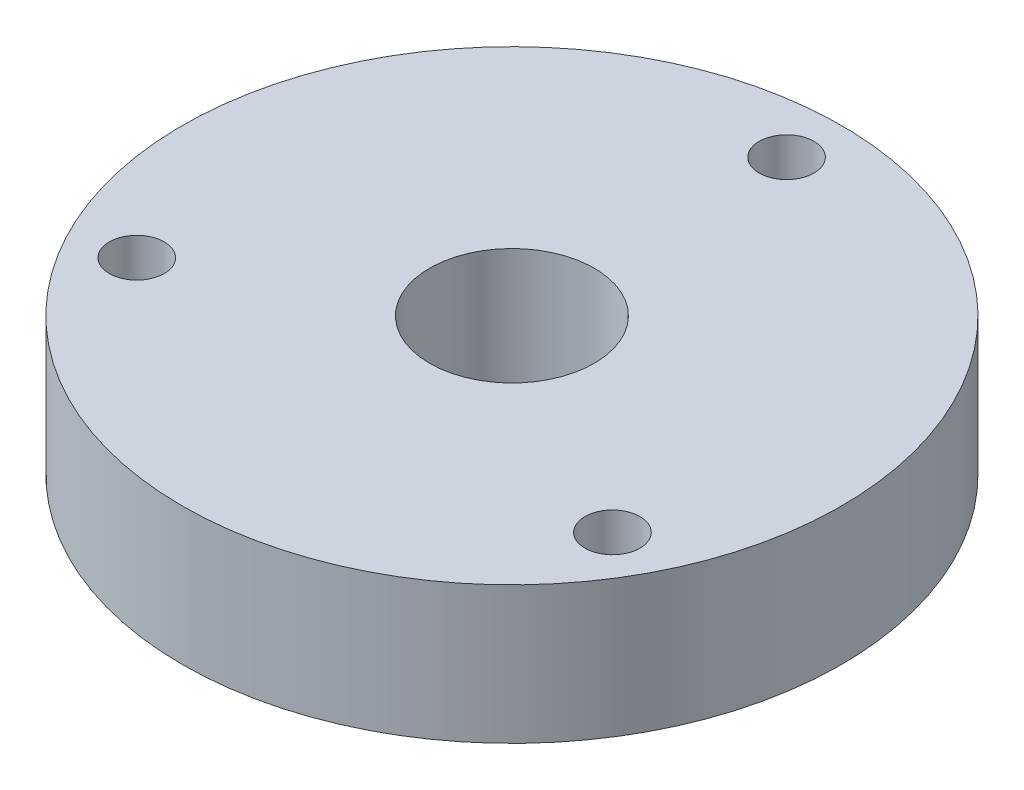
from build123d import *

# Parameters (mm, degrees)
SKETCH1_R           = 12
SKETCH1_R_2         = 1
SKETCH1_R_3         = 3
BOSS_EXTRUDE1_DEPTH = 5


with BuildPart() as part:
    # Sketch1 → Boss-Extrude1 (new body)
    with BuildSketch(Plane(origin=(0, 0, 0), x_dir=(1, 0, 0), z_dir=(0, 1, 0))):
        with Locations(Location((0, 0, 0), (0, 0, 270))):
            Circle(SKETCH1_R)
        with Locations(Location((0, 10, 0), (0, 0, 270))):
            Circle(SKETCH1_R_2, mode=Mode.SUBTRACT)
        with Locations(Location((0, 0, 0), (0, 0, 270))):
            Circle(SKETCH1_R_3, mode=Mode.SUBTRACT)
        with Locations(Location((8.660254038, -5, 0), (0, 0, 270))):
            Circle(SKETCH1_R_2, mode=Mode.SUBTRACT)
        with Locations(Location((-8.660254038, -5, 0), (0, 0, 270))):
            Circle(SKETCH1_R_2, mode=Mode.SUBTRACT)
    extrude(amount=BOSS_EXTRUDE1_DEPTH)


solid = part.part
